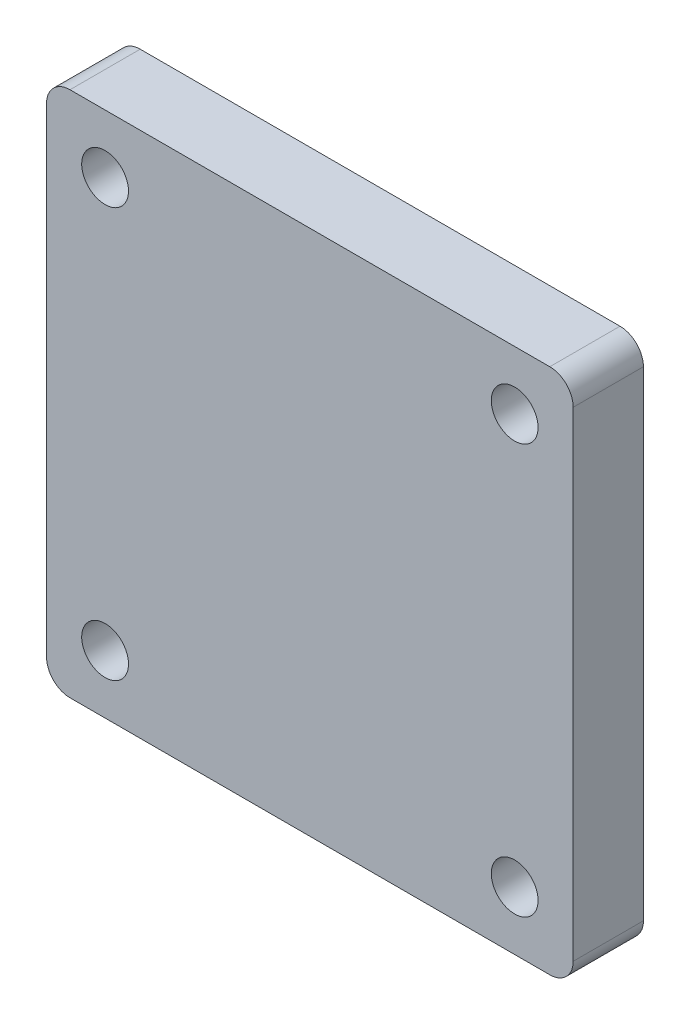
from build123d import *

# Parameters (mm, degrees)
SKETCH1_W           = 22.5
SKETCH1_H           = 22.5
SKETCH1_R           = 1
BOSS_EXTRUDE1_DEPTH = 3
FILLET1_R           = 1


with BuildPart() as part:
    # Sketch1 → Boss-Extrude1 (new body)
    with BuildSketch(Plane.XY):
        with Locations((11.25, 11.25)):
            Rectangle(SKETCH1_W, SKETCH1_H)
        with Locations((2.5, 20)):
            Circle(SKETCH1_R, mode=Mode.SUBTRACT)
        with Locations((20, 20)):
            Circle(SKETCH1_R, mode=Mode.SUBTRACT)
        with Locations((20, 2.5)):
            Circle(SKETCH1_R, mode=Mode.SUBTRACT)
        with Locations((2.5, 2.5)):
            Circle(SKETCH1_R, mode=Mode.SUBTRACT)
    extrude(amount=BOSS_EXTRUDE1_DEPTH)

    # Fillet1
    fillet1_edges = [part.edges().sort_by_distance(p)[0] for p in [
        (0, 22.5, 1.5),
        (22.5, 22.5, 1.5),
        (22.5, 0, 1.5),
        (0, 0, 1.5),
    ]]
    fillet(fillet1_edges, radius=FILLET1_R)


solid = part.part
